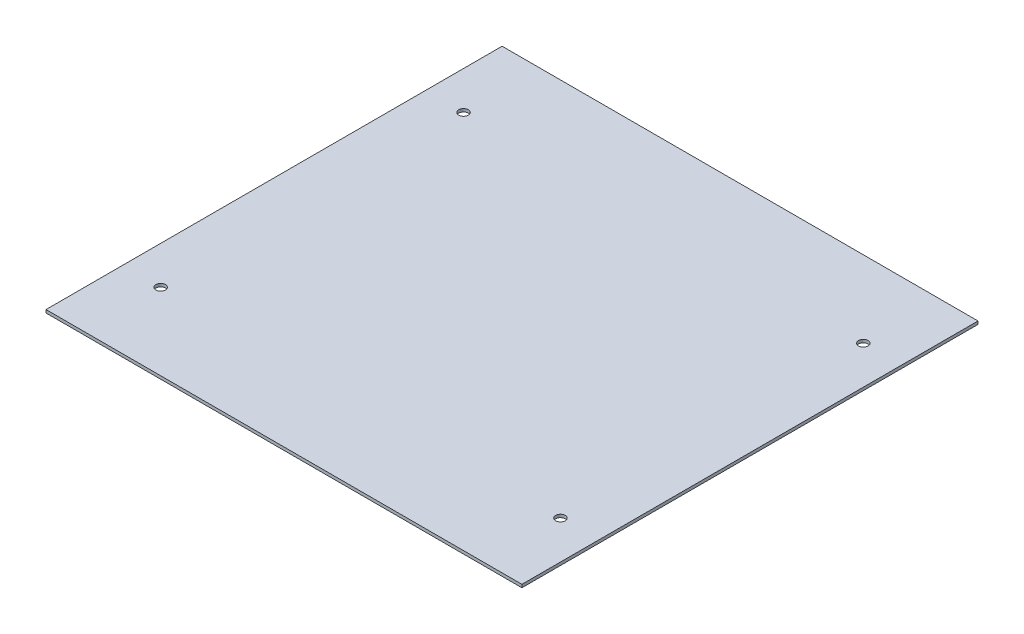
from build123d import *

# Parameters (mm, degrees)
SKETCH1_W           = 500
SKETCH1_H           = 479.2
BOSS_EXTRUDE1_DEPTH = 3.175
CUT_EXTRUDE1_REACH  = 348.292
SKETCH2_R           = 5


with BuildPart() as part:
    # Sketch1 → Boss-Extrude1 (new body)
    with BuildSketch(Plane(origin=(0, 0, 0), x_dir=(1, 0, 0), z_dir=(0, 1, 0))):
        Rectangle(SKETCH1_W, SKETCH1_H)
    extrude(amount=BOSS_EXTRUDE1_DEPTH)

    # Sketch2 → Cut-Extrude1 (cut, up to next)
    with BuildSketch(Plane(origin=(0, 3.175, 0), x_dir=(1, 0, 0), z_dir=(0, 1, 0)), mode=Mode.PRIVATE) as cut_extrude1_sk1:
        with Locations(Location((-210, 159.1, 0), (0, 0, 270))):
            Circle(SKETCH2_R)
    cut_extrude1_tool1 = extrude(cut_extrude1_sk1.sketch, amount=-CUT_EXTRUDE1_REACH, mode=Mode.PRIVATE) & part.part
    # Sketch2 → Cut-Extrude1 (cut, up to next)
    with BuildSketch(Plane(origin=(0, 3.175, 0), x_dir=(1, 0, 0), z_dir=(0, 1, 0)), mode=Mode.PRIVATE) as cut_extrude1_sk2:
        with Locations(Location((210, 159.1, 0), (0, 0, 270))):
            Circle(SKETCH2_R)
    cut_extrude1_tool2 = extrude(cut_extrude1_sk2.sketch, amount=-CUT_EXTRUDE1_REACH, mode=Mode.PRIVATE) & part.part
    # Sketch2 → Cut-Extrude1 (cut, up to next)
    with BuildSketch(Plane(origin=(0, 3.175, 0), x_dir=(1, 0, 0), z_dir=(0, 1, 0)), mode=Mode.PRIVATE) as cut_extrude1_sk3:
        with Locations(Location((-210, -159.1, 0), (0, 0, 270))):
            Circle(SKETCH2_R)
    cut_extrude1_tool3 = extrude(cut_extrude1_sk3.sketch, amount=-CUT_EXTRUDE1_REACH, mode=Mode.PRIVATE) & part.part
    # Sketch2 → Cut-Extrude1 (cut, up to next)
    with BuildSketch(Plane(origin=(0, 3.175, 0), x_dir=(1, 0, 0), z_dir=(0, 1, 0)), mode=Mode.PRIVATE) as cut_extrude1_sk4:
        with Locations(Location((210, -159.1, 0), (0, 0, 270))):
            Circle(SKETCH2_R)
    cut_extrude1_tool4 = extrude(cut_extrude1_sk4.sketch, amount=-CUT_EXTRUDE1_REACH, mode=Mode.PRIVATE) & part.part
    add(cut_extrude1_tool1.solids().sort_by_distance((-210, 3.175, -159.1))[0], mode=Mode.SUBTRACT)
    add(cut_extrude1_tool2.solids().sort_by_distance((210, 3.175, -159.1))[0], mode=Mode.SUBTRACT)
    add(cut_extrude1_tool3.solids().sort_by_distance((-210, 3.175, 159.1))[0], mode=Mode.SUBTRACT)
    add(cut_extrude1_tool4.solids().sort_by_distance((210, 3.175, 159.1))[0], mode=Mode.SUBTRACT)


solid = part.part
